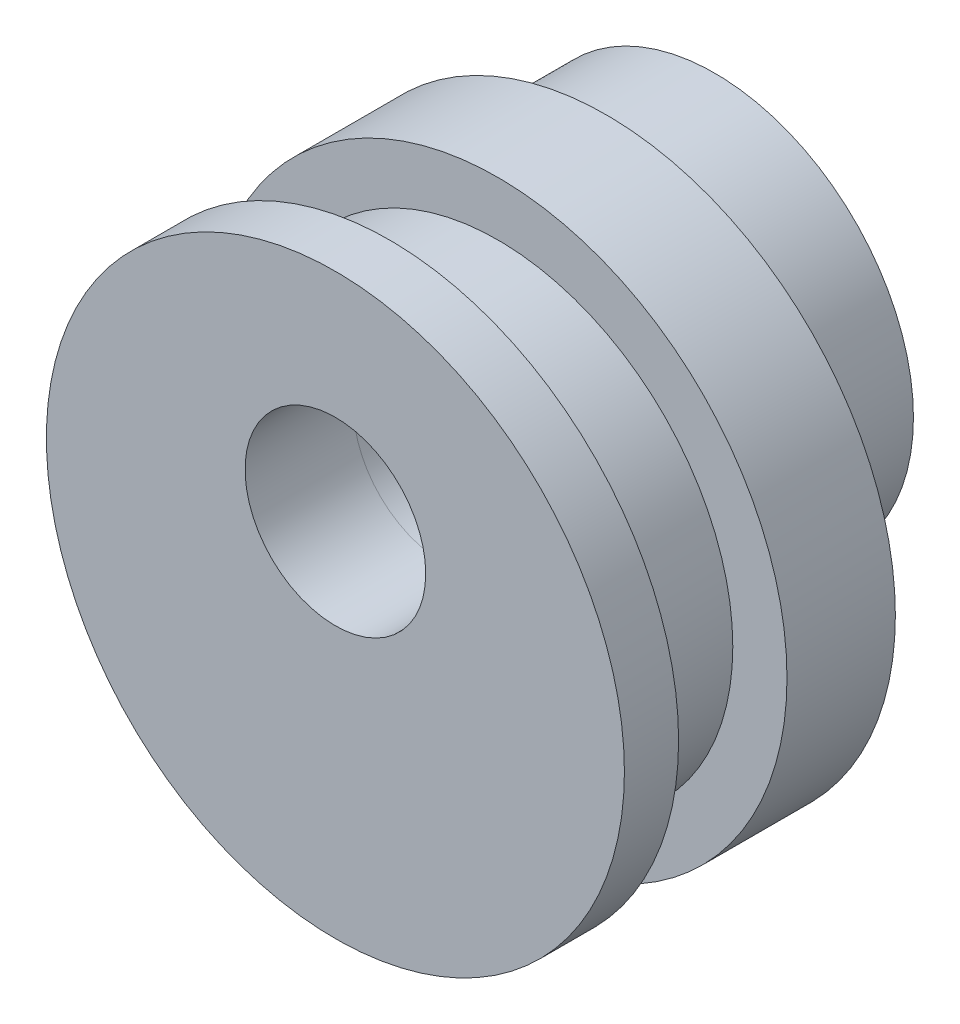
from build123d import *

# Parameters (mm, degrees)
SKETCH1_R                 = 16
SKETCH1_R_2               = 13
BOSS_EXTRUDE1_DEPTH       = 6
SKETCH1_4_R               = 13
SKETCH1_4_R_2             = 5
BOSS_EXTRUDE2_DEPTH       = 12
BOSS_EXTRUDE3_START       = -6
SKETCH1_5_R               = 11
SKETCH1_5_R_2             = 5
BOSS_EXTRUDE3_DEPTH       = 6
CUT_EXTRUDE1_START        = -3
SKETCH2_R                 = 9.5
SKETCH2_R_2               = 5
CUT_EXTRUDE1_DEPTH        = 3
SKETCH2_3_R               = 9.5
SKETCH2_3_R_2             = 5
BOSS_EXTRUDE4_DEPTH       = 3
SKETCH3_R                 = 16
SKETCH3_R_2               = 5
BOSS_EXTRUDE5_DEPTH       = 3
CUT_EXTRUDE2_REACH        = 29.148
CUT_EXTRUDE2_END_RADIUS   = 11
SKETCH4_R                 = 1.5
CIRPATTERN1_COUNT         = 2
CIRPATTERN1_ANGLE         = 45
MIRROR1_COPY_1_REACH      = 29.148
MIRROR1_COPY_1_END_RADIUS = 11
MIRROR1_COPY_1_SKETCH_R   = 1.5


with BuildPart() as part:
    # Sketch1 → Boss-Extrude1 (new body)
    with BuildSketch(Plane.XY):
        Circle(SKETCH1_R)
        Circle(SKETCH1_R_2, mode=Mode.SUBTRACT)
    extrude(amount=BOSS_EXTRUDE1_DEPTH)

    # Sketch1<4> → Boss-Extrude2 (add)
    with BuildSketch(Plane.XY):
        Circle(SKETCH1_4_R)
        with Locations((0, 4)):
            Circle(SKETCH1_4_R_2, mode=Mode.SUBTRACT)
    extrude(amount=BOSS_EXTRUDE2_DEPTH)

    # Sketch1<5> → Boss-Extrude3 (add)
    with BuildSketch(Plane.XY.offset(BOSS_EXTRUDE3_START)):
        with Locations((0, 4)):
            Circle(SKETCH1_5_R)
        with Locations((0, 4)):
            Circle(SKETCH1_5_R_2, mode=Mode.SUBTRACT)
    extrude(amount=BOSS_EXTRUDE3_DEPTH)

    # Sketch2 → Cut-Extrude1 (cut)
    with BuildSketch(Plane.XY.offset(12).offset(CUT_EXTRUDE1_START)):
        Circle(SKETCH2_R)
        with Locations((0, 4)):
            Circle(SKETCH2_R_2, mode=Mode.SUBTRACT)
    extrude(amount=CUT_EXTRUDE1_DEPTH, mode=Mode.SUBTRACT)

    # Cut-Extrude2: up to this cylinder (the profile starts inside it)
    cut_extrude2_end = Plane(origin=(0, 4, -3), z_dir=(0, 0, 1)) * Cylinder(CUT_EXTRUDE2_END_RADIUS, 81.296, mode=Mode.PRIVATE)
    # Sketch4 → Cut-Extrude2 (cut, up to the surface)
    with BuildSketch(Plane(origin=(0, 0, 0), x_dir=(1, 0, 0), z_dir=(0, 1, 0)), mode=Mode.PRIVATE) as cut_extrude2_sk1:
        with Locations(Location((0, 3, 0), (0, 0, 270))):
            Circle(SKETCH4_R)
    cut_extrude2_tool1 = extrude(cut_extrude2_sk1.sketch, amount=-CUT_EXTRUDE2_REACH, mode=Mode.PRIVATE) & cut_extrude2_end
    cut_extrude2 = cut_extrude2_tool1.solids().sort_by_distance((0, 0, -3))[0]
    add(cut_extrude2, mode=Mode.SUBTRACT)

    # CirPattern1: Cut-Extrude2 ×2 about axis
    cirpattern1_axis = Axis((0, 4, -6), (0, 0, 1))
    for i in range(1, CIRPATTERN1_COUNT):
        add(cut_extrude2.rotate(cirpattern1_axis, i * CIRPATTERN1_ANGLE / (CIRPATTERN1_COUNT - 1)), mode=Mode.SUBTRACT)

    # Mirror1 copy 1: up to this cylinder (the profile starts inside it)
    mirror1_copy_1_end = Plane(origin=(0, 4, -3), z_dir=(0, 0, 1)) * Cylinder(MIRROR1_COPY_1_END_RADIUS, 81.296, mode=Mode.PRIVATE)
    # Mirror1 copy 1 sketch → Mirror1 copy 1 (cut, up to the surface)
    with BuildSketch(Plane(origin=(-2.828427125, 1.171572875, 0), x_dir=(-0.7071067811865462, 0.7071067811865488, 0), z_dir=(0.7071067811865488, 0.7071067811865462, 0)), mode=Mode.PRIVATE) as mirror1_copy_1_sk1:
        with Locations((0, -3)):
            Circle(MIRROR1_COPY_1_SKETCH_R)
    mirror1_copy_1_tool1 = extrude(mirror1_copy_1_sk1.sketch, amount=-MIRROR1_COPY_1_REACH, mode=Mode.PRIVATE) & mirror1_copy_1_end
    add(mirror1_copy_1_tool1.solids().sort_by_distance((0, 0, -3))[0], mode=Mode.SUBTRACT)


with BuildPart() as body_2:
    # Sketch2<3> → Boss-Extrude4 (new body)
    with BuildSketch(Plane.XY.offset(12)):
        Circle(SKETCH2_3_R)
        with Locations((0, 4)):
            Circle(SKETCH2_3_R_2, mode=Mode.SUBTRACT)
    extrude(amount=-BOSS_EXTRUDE4_DEPTH)

    # Sketch3 → Boss-Extrude5 (add)
    with BuildSketch(Plane.XY.offset(12)):
        Circle(SKETCH3_R)
        with Locations((0, 4)):
            Circle(SKETCH3_R_2, mode=Mode.SUBTRACT)
    extrude(amount=BOSS_EXTRUDE5_DEPTH)


solid = Compound([part.part, body_2.part])
